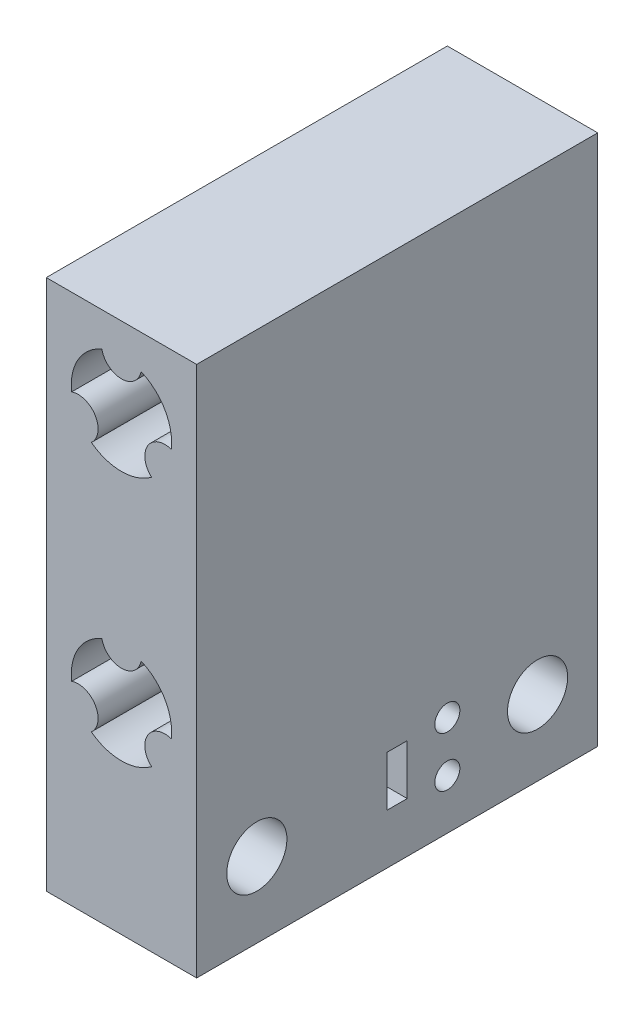
from build123d import *

# Parameters (mm, degrees)
SKETCH1_W           = 19.05
SKETCH1_H           = 57.15
BOSS_EXTRUDE1_DEPTH = 50.8
SKETCH1_4_R         = 6.35
CUT_EXTRUDE1_DEPTH  = 60.05841388
SKETCH1_5_R         = 2.54
BOSS_EXTRUDE2_DEPTH = 50.8
SKETCH1_6_R         = 6.35
CUT_EXTRUDE2_DEPTH  = 60.05841388
SKETCH1_7_R         = 2.54
BOSS_EXTRUDE3_DEPTH = 50.8
SKETCH11_W          = 19.05
SKETCH11_H          = 50.8
CUT_EXTRUDE12_DEPTH = 2.54
SKETCH12_W          = 19.05
SKETCH12_H          = 50.8
BOSS_EXTRUDE4_DEPTH = 12.7
SKETCH13_R          = 3.81
CUT_EXTRUDE15_DEPTH = 69.170141008
SKETCH13_6_W        = 2.54
SKETCH13_6_H        = 6.35
CUT_EXTRUDE16_DEPTH = 69.170141008
SKETCH13_7_R        = 1.5875
CUT_EXTRUDE17_DEPTH = 69.170141008


with BuildPart() as part:
    # Sketch1 → Boss-Extrude1 (new body)
    with BuildSketch(Plane.XY):
        Rectangle(SKETCH1_W, SKETCH1_H)
    extrude(amount=BOSS_EXTRUDE1_DEPTH)

    # Sketch1<4> → Cut-Extrude1 (cut, through all)
    with BuildSketch(Plane.XY):
        with Locations((0, -15.875)):
            Circle(SKETCH1_4_R)
    extrude(amount=CUT_EXTRUDE1_DEPTH, mode=Mode.SUBTRACT)

    # Sketch1<5> → Boss-Extrude2 (add, through all)
    with BuildSketch(Plane.XY):
        with Locations((0, -9.525)):
            Circle(SKETCH1_5_R)
        with Locations((5.499261314, -19.05)):
            Circle(SKETCH1_5_R)
        with Locations((-5.499261314, -19.05)):
            Circle(SKETCH1_5_R)
    extrude(amount=BOSS_EXTRUDE2_DEPTH)

    # Sketch1<6> → Cut-Extrude2 (cut, through all)
    with BuildSketch(Plane.XY):
        with Locations((0, 15.875)):
            Circle(SKETCH1_6_R)
    extrude(amount=CUT_EXTRUDE2_DEPTH, mode=Mode.SUBTRACT)

    # Sketch1<7> → Boss-Extrude3 (add, through all)
    with BuildSketch(Plane.XY):
        with Locations((0, 22.225)):
            Circle(SKETCH1_7_R)
        with Locations((5.499261314, 12.7)):
            Circle(SKETCH1_7_R)
        with Locations((-5.499261314, 12.7)):
            Circle(SKETCH1_7_R)
    extrude(amount=BOSS_EXTRUDE3_DEPTH)

    # Sketch11 → Cut-Extrude12 (cut)
    with BuildSketch(Plane(origin=(0, 28.575, 0), x_dir=(1, 0, 0), z_dir=(0, 1, 0))):
        with Locations((0, -25.4)):
            Rectangle(SKETCH11_W, SKETCH11_H)
    extrude(amount=-CUT_EXTRUDE12_DEPTH, mode=Mode.SUBTRACT)

    # Sketch12 → Boss-Extrude4 (add)
    with BuildSketch(Plane.XZ.offset(28.575)):
        with Locations((0, 25.4)):
            Rectangle(SKETCH12_W, SKETCH12_H)
    extrude(amount=BOSS_EXTRUDE4_DEPTH)

    # Sketch13 → Cut-Extrude15 (cut, through all)
    with BuildSketch(Plane(origin=(9.525, 0, 0), x_dir=(0, 0, -1), z_dir=(1, 0, 0))):
        with Locations(Location((-43.18, -31.75, 0), (0, 0, 90))):
            Circle(SKETCH13_R)
        with Locations(Location((-7.62, -31.75, 0), (0, 0, 90))):
            Circle(SKETCH13_R)
    extrude(amount=-CUT_EXTRUDE15_DEPTH, mode=Mode.SUBTRACT)

    # Sketch13<6> → Cut-Extrude16 (cut, through all)
    with BuildSketch(Plane(origin=(9.525, 0, 0), x_dir=(0, 0, -1), z_dir=(1, 0, 0))):
        with Locations((-25.4, -31.75)):
            Rectangle(SKETCH13_6_W, SKETCH13_6_H)
    extrude(amount=-CUT_EXTRUDE16_DEPTH, mode=Mode.SUBTRACT)

    # Sketch13<7> → Cut-Extrude17 (cut, through all)
    with BuildSketch(Plane(origin=(9.525, 0, 0), x_dir=(0, 0, -1), z_dir=(1, 0, 0))):
        with Locations(Location((-19.05, -28.575, 0), (0, 0, 90))):
            Circle(SKETCH13_7_R)
        with Locations(Location((-19.05, -34.925, 0), (0, 0, 90))):
            Circle(SKETCH13_7_R)
    extrude(amount=-CUT_EXTRUDE17_DEPTH, mode=Mode.SUBTRACT)


solid = part.part
